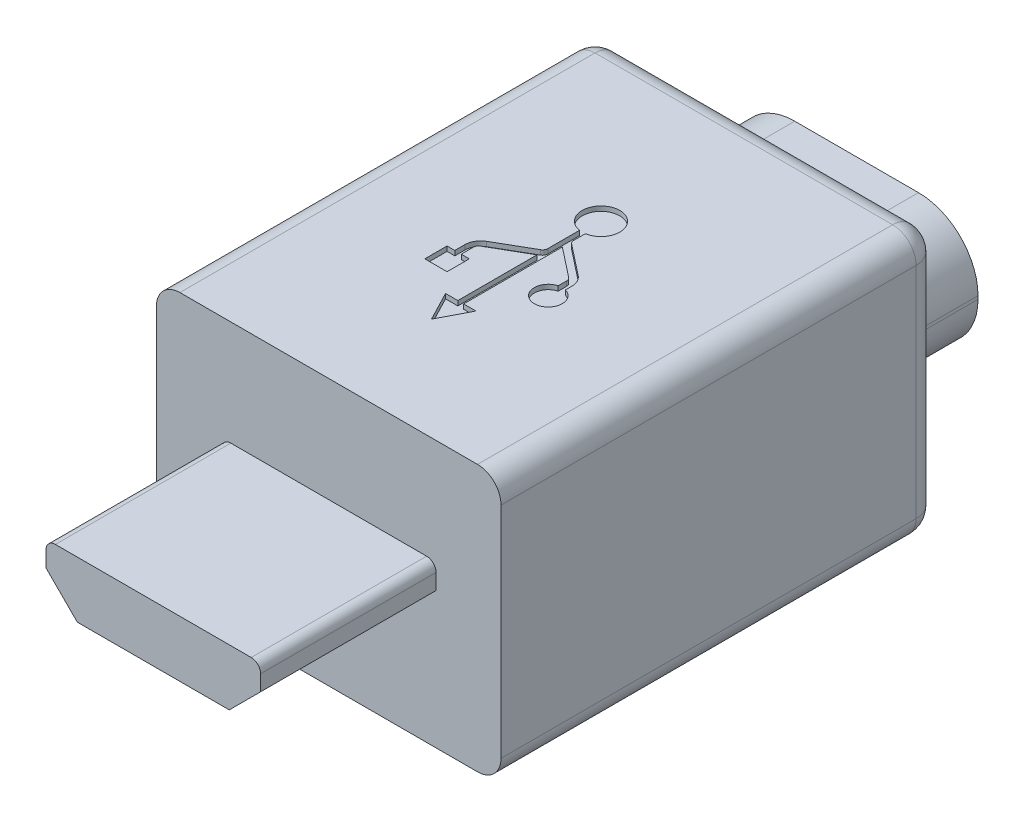
from build123d import *

# Parameters (mm, degrees)
SKETCH1_W           = 11
SKETCH1_H           = 8.5
BOSS_EXTRUDE1_DEPTH = 14
SKETCH2_W           = 7.75
SKETCH2_H           = 3.9
BOSS_EXTRUDE2_DEPTH = 2.85
SKETCH4_W           = 6.85
SKETCH4_H           = 1.8
BOSS_EXTRUDE4_DEPTH = 5.6
FILLET6_R           = 0.3
CHAMFER1_SIZE       = 1
CUT_EXTRUDE1_DEPTH  = 0.15
CIRPATTERN1_COUNT   = 2
FILLET1_R           = 1.9
FILLET3_R           = 0.75
FILLET4_R           = 0.75


with BuildPart() as part:
    # Sketch1 → Boss-Extrude1 (new body)
    with BuildSketch(Plane.XY):
        Rectangle(SKETCH1_W, SKETCH1_H)
    extrude(amount=-BOSS_EXTRUDE1_DEPTH)

    # Sketch2 → Boss-Extrude2 (add)
    with BuildSketch(Plane(origin=(0, 0, -14), x_dir=(-1, 0, 0), z_dir=(0, 0, -1))):
        Rectangle(SKETCH2_W, SKETCH2_H)
    extrude(amount=BOSS_EXTRUDE2_DEPTH)

    # Sketch4 → Boss-Extrude4 (add)
    with BuildSketch(Plane.XY):
        Rectangle(SKETCH4_W, SKETCH4_H)
    extrude(amount=BOSS_EXTRUDE4_DEPTH)

    # Fillet6
    fillet6_edges = [part.edges().sort_by_distance(p)[0] for p in [
        (3.425, 0.9, 2.8),
        (-3.425, 0.9, 2.8),
    ]]
    fillet(fillet6_edges, radius=FILLET6_R)

    # Chamfer1
    chamfer1_edges = [part.edges().sort_by_distance(p)[0] for p in [
        (-3.425, -0.9, 2.8),
        (3.425, -0.9, 2.8),
    ]]
    chamfer(chamfer1_edges, length=CHAMFER1_SIZE)

    # Sketch5 → Cut-Extrude1 (cut)
    with BuildSketch(Plane.XZ.offset(4.25)):
        with BuildLine():
            Line((0, -3.279495805), (-0.485840634, -4.214842566))
            Line((-0.485840634, -4.214842566), (-0.093629021, -4.214842566))
            Line((-0.093629021, -4.214842566), (-0.093629021, -7.363659965))
            Line((-0.093629021, -7.363659965), (-1.035027967, -6.623865099))
            ThreePointArc((-1.035027967, -6.623865099), (-1.082535613, -6.564943154), (-1.099509752, -6.491182388))
            Line((-1.099509752, -6.491182388), (-1.099509752, -6.225332236))
            ThreePointArc((-1.099509752, -6.225332236), (-1.214270304, -5.348067145), (-1.329030856, -6.225332236))
            Line((-1.329030856, -6.225332236), (-1.329030856, -6.428798928))
            ThreePointArc((-1.329030856, -6.428798928), (-1.278108438, -6.650081225), (-1.135585502, -6.82684706))
            Line((-1.135585502, -6.82684706), (-0.158110806, -7.59499192))
            ThreePointArc((-0.158110806, -7.59499192), (-0.11060316, -7.653913865), (-0.093629021, -7.727674631))
            Line((-0.093629021, -7.727674631), (-0.093629021, -8.098323238))
            ThreePointArc((-0.093629021, -8.098323238), (0, -9.291083784), (0.093629021, -8.098323238))
            Line((0.093629021, -8.098323238), (0.093629021, -7.087908213))
            ThreePointArc((0.093629021, -7.087908213), (0.116268533, -7.003479025), (0.178112432, -6.941703889))
            Line((0.178112432, -6.941703889), (1.273368459, -6.310440139))
            ThreePointArc((1.273368459, -6.310440139), (1.458900155, -6.12511473), (1.526818691, -5.871827167))
            Line((1.526818691, -5.871827167), (1.526818691, -5.55143287))
            Line((1.526818691, -5.55143287), (1.774241614, -5.55143287))
            Line((1.774241614, -5.55143287), (1.774241614, -4.840448102))
            Line((1.774241614, -4.840448102), (1.063256846, -4.840448102))
            Line((1.063256846, -4.840448102), (1.063256846, -5.55143287))
            Line((1.063256846, -5.55143287), (1.321069322, -5.55143287))
            Line((1.321069322, -5.55143287), (1.321069322, -5.935219876))
            ThreePointArc((1.321069322, -5.935219876), (1.29842981, -6.019649064), (1.236585912, -6.081424201))
            Line((1.236585912, -6.081424201), (0.093629021, -6.740180906))
            Line((0.093629021, -6.740180906), (0.093629021, -4.214842566))
            Line((0.093629021, -4.214842566), (0.485840634, -4.214842566))
            Line((0.485840634, -4.214842566), (0, -3.279495805))
        make_face()
    cut_extrude1 = extrude(amount=-CUT_EXTRUDE1_DEPTH, mode=Mode.SUBTRACT)

    # CirPattern1: Cut-Extrude1 ×2 about axis
    cirpattern1_axis = Axis((0, 0, -122.9725), (0, 0, 1))
    for i in range(1, CIRPATTERN1_COUNT):
        add(cut_extrude1.rotate(cirpattern1_axis, i * 360 / CIRPATTERN1_COUNT), mode=Mode.SUBTRACT)

    # Fillet1
    fillet1_edges = [part.edges().sort_by_distance(p)[0] for p in [
        (-3.875, -1.95, -15.425),
        (-3.875, 1.95, -15.425),
        (3.875, -1.95, -15.425),
        (3.875, 1.95, -15.425),
    ]]
    fillet(fillet1_edges, radius=FILLET1_R)

    # Fillet3
    fillet3_edges = [part.edges().sort_by_distance(p)[0] for p in [
        (5.5, -4.25, -7),
        (-5.5, -4.25, -7),
        (-5.5, 4.25, -7),
        (5.5, 4.25, -7),
    ]]
    fillet(fillet3_edges, radius=FILLET3_R)

    # Fillet4
    fillet4_edges = [part.edges().sort_by_distance(p)[0] for p in [
        (5.280330086, 4.030330086, -14),
        (5.5, 0, -14),
        (5.280330086, -4.030330086, -14),
        (0, -4.25, -14),
        (-5.280330086, -4.030330086, -14),
        (-5.5, 0, -14),
        (-5.280330086, 4.030330086, -14),
        (0, 4.25, -14),
    ]]
    fillet(fillet4_edges, radius=FILLET4_R)


solid = part.part
